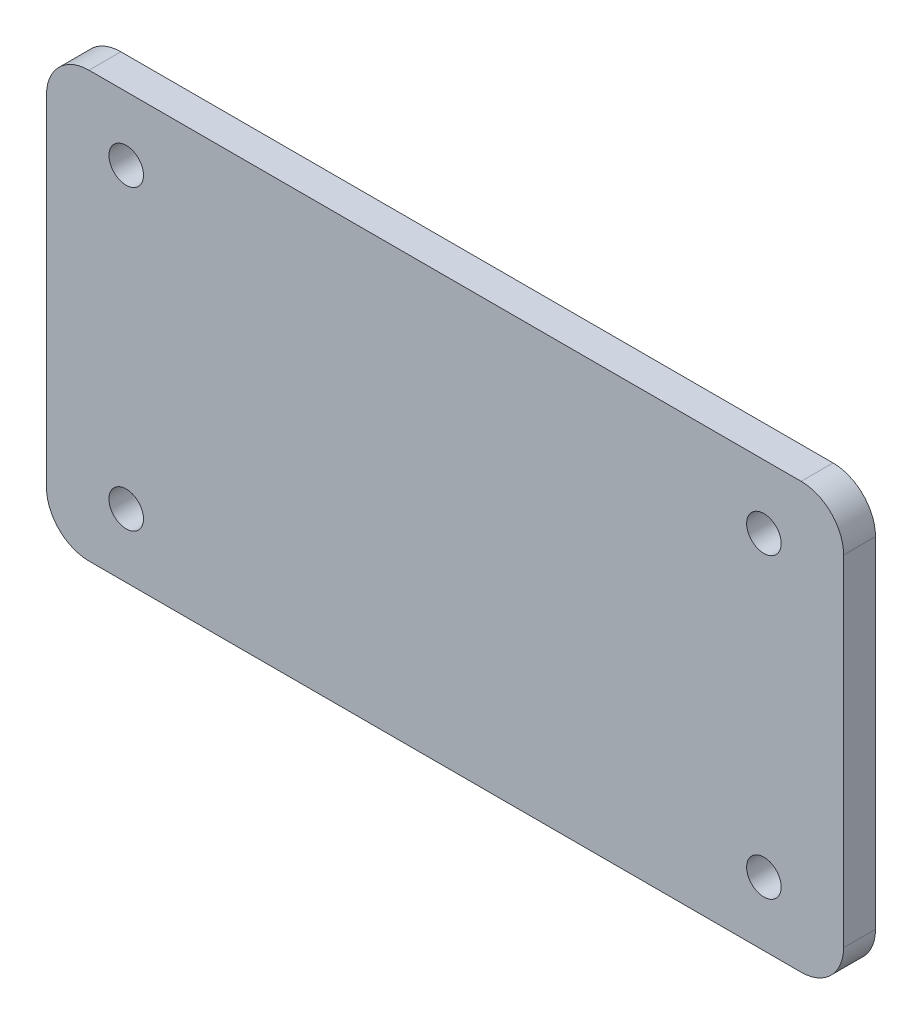
from build123d import *

# Parameters (mm, degrees)
SKETCH2_W               = 150
SKETCH2_H               = 80
BOSS_EXTRUDE1_DEPTH     = 3
CUT_EXTRUDE1_DEPTH      = 86.211501571
CUT_EXTRUDE1_DEPTH_BACK = 86.211501571
SKETCH3_R               = 3.25
FILLET2_R               = 8


with BuildPart() as part:
    # Sketch2 → Boss-Extrude1 (new, symmetric)
    with BuildSketch(Plane.XY):
        Rectangle(SKETCH2_W, SKETCH2_H)
    extrude(amount=BOSS_EXTRUDE1_DEPTH, both=True)

    # Sketch3 → Cut-Extrude1 (cut, two sides: drawn at the far end of the back side and taken through both)
    with BuildSketch(Plane.XY.offset(3).offset(-CUT_EXTRUDE1_DEPTH_BACK)):
        with Locations((-60, 28)):
            Circle(SKETCH3_R)
        with Locations((-60, -28)):
            Circle(SKETCH3_R)
        with Locations((60, -28)):
            Circle(SKETCH3_R)
        with Locations((60, 28)):
            Circle(SKETCH3_R)
    extrude(amount=CUT_EXTRUDE1_DEPTH + CUT_EXTRUDE1_DEPTH_BACK, mode=Mode.SUBTRACT)

    # Fillet2
    fillet2_edges = [part.edges().sort_by_distance(p)[0] for p in [
        (75, -40, 0),
        (-75, -40, 0),
        (-75, 40, 0),
        (75, 40, 0),
    ]]
    fillet(fillet2_edges, radius=FILLET2_R)


solid = part.part
